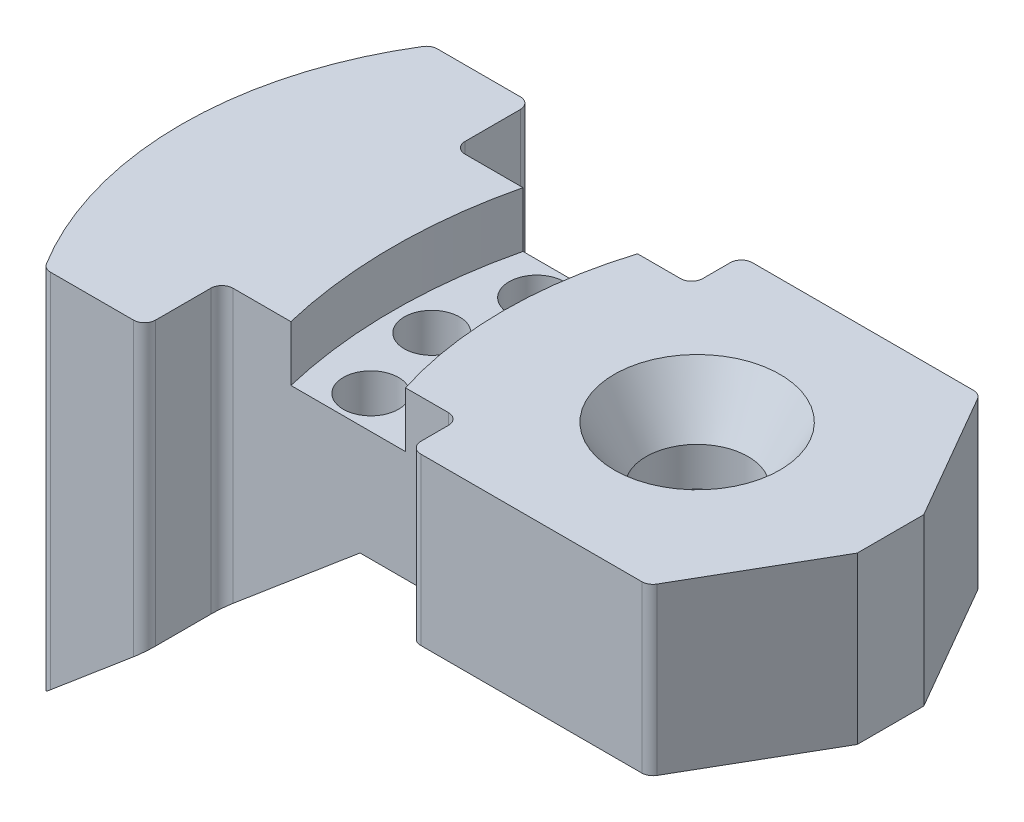
from build123d import *

# Parameters (mm, degrees)
BOSS_EXTRUDE2_DEPTH = 75
CUT_EXTRUDE1_DEPTH  = 50
CUT_EXTRUDE2_DEPTH  = 10
SKETCH7_R           = 5
CUT_EXTRUDE3_DEPTH  = 10
SKETCH8_R           = 7.5
CUT_EXTRUDE4_DEPTH  = 153.707924315


with BuildPart() as part:
    # Sketch3 → Boss-Extrude2 (new body)
    with BuildSketch(Plane(origin=(0, 0, 0), x_dir=(1, 0, 0), z_dir=(0, 1, 0))):
        with BuildLine():
            Line((0, -6.019237886), (0, 6.019237886))
            Line((0, 6.019237886), (-13.267949192, 29))
            ThreePointArc((-13.267949192, 29), (-14, 29.732050808), (-15, 30))
            Line((-15, 30), (-55, 30))
            ThreePointArc((-55, 30), (-56.414213562, 29.414213562), (-57, 28))
            Line((-57, 28), (-57, 23))
            ThreePointArc((-57, 23), (-57.585786438, 21.585786438), (-59, 21))
            Line((-59, 21), (-98, 21))
            ThreePointArc((-98, 21), (-99.414213562, 21.585786438), (-100, 23))
            Line((-100, 23), (-100, 33))
            ThreePointArc((-100, 33), (-100.585786438, 34.414213562), (-102, 35))
            Line((-102, 35), (-117, 35))
            ThreePointArc((-117, 35), (-117.975900073, 34.745743122), (-118.70367084, 34.047619048))
            ThreePointArc((-118.70367084, 34.047619048), (-128.33436854, 0), (-118.70367084, -34.047619048))
            ThreePointArc((-118.70367084, -34.047619048), (-117.975900073, -34.745743122), (-117, -35))
            Line((-117, -35), (-102, -35))
            ThreePointArc((-102, -35), (-100.585786438, -34.414213562), (-100, -33))
            Line((-100, -33), (-100, -23))
            ThreePointArc((-100, -23), (-99.414213562, -21.585786438), (-98, -21))
            Line((-98, -21), (-59, -21))
            ThreePointArc((-59, -21), (-57.585786438, -21.585786438), (-57, -23))
            Line((-57, -23), (-57, -28))
            ThreePointArc((-57, -28), (-56.414213562, -29.414213562), (-55, -30))
            Line((-55, -30), (-15, -30))
            ThreePointArc((-15, -30), (-14, -29.732050808), (-13.267949192, -29))
            Line((-13.267949192, -29), (0, -6.019237886))
        make_face()
    extrude(amount=BOSS_EXTRUDE2_DEPTH)

    # Sketch4 → Cut-Extrude1 (cut, symmetric)
    with BuildSketch(Plane.XY):
        Polygon((0, 45), (-75, 45), (-128.33436854, 0), (0, 0), align=None)
    extrude(amount=CUT_EXTRUDE1_DEPTH, both=True, mode=Mode.SUBTRACT)

    # Sketch5 → Cut-Revolve1 (revolve, cut)
    with BuildSketch(Plane.XY, mode=Mode.PRIVATE) as cut_revolve1_sk:
        Polygon((-35, 75), (-50, 75), (-44.226497308, 65), (-44.226497308, 57.990381057), (-42.5, 55), (-42.5, 45), (-35, 45), align=None)
    revolve(cut_revolve1_sk.sketch.rotate(Axis((-35, 75, 0), (0, -1, 0)), 270), axis=Axis((-35, 75, 0), (0, -1, 0)), mode=Mode.SUBTRACT)

    # Sketch6 → Cut-Extrude2 (cut)
    with BuildSketch(Plane(origin=(0, 75, 0), x_dir=(1, 0, 0), z_dir=(0, 1, 0))):
        with BuildLine():
            Line((-55.908593, 42.121600501), (-57.789518761, 68.995445657))
            ThreePointArc((-57.789518761, 68.995445657), (-88.91346012, 13.942618456), (-76.134860141, -47.994615024))
            Line((-76.134860141, -47.994615024), (-58.539070897, -38.381990289))
            ThreePointArc((-58.539070897, -38.381990289), (-69.962661294, 2.286050005), (-55.908593, 42.121600501))
        make_face()
    extrude(amount=-CUT_EXTRUDE2_DEPTH, mode=Mode.SUBTRACT)

    # Sketch7 → Cut-Extrude3 (cut)
    with BuildSketch(Plane(origin=(0, 65, 0), x_dir=(1, 0, 0), z_dir=(0, 1, 0))):
        with Locations(Location((-79.033128747, 15, 0), (0, 0, 270))):
            Circle(SKETCH7_R)
        with Locations(Location((-83, 0, 0), (0, 0, 270))):
            Circle(SKETCH7_R)
        with Locations(Location((-79.033128747, -15, 0), (0, 0, 270))):
            Circle(SKETCH7_R)
    extrude(amount=-CUT_EXTRUDE3_DEPTH, mode=Mode.SUBTRACT)

    # Sketch8 → Cut-Extrude4 (cut, through all)
    with BuildSketch(Plane(origin=(0, 0, 0), x_dir=(0, 0, -1), z_dir=(1, 0, 0))):
        with Locations(Location((0, 25, 0), (0, 0, 90))):
            Circle(SKETCH8_R)
    extrude(amount=-CUT_EXTRUDE4_DEPTH, mode=Mode.SUBTRACT)


solid = part.part
